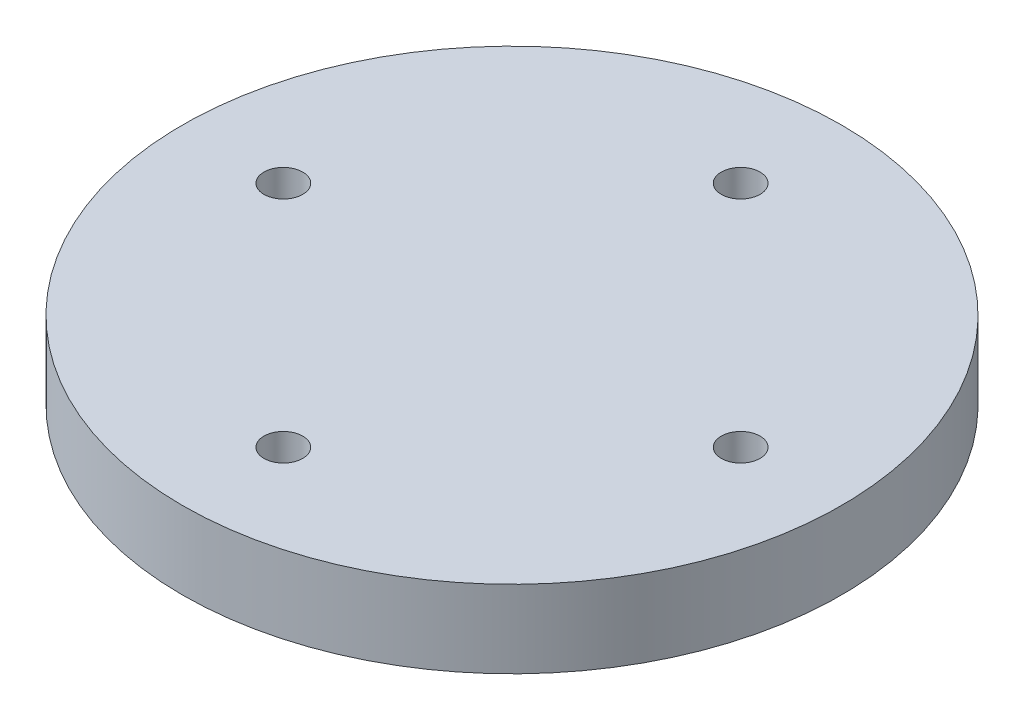
from build123d import *

# Parameters (mm, degrees)
SKETCH_1_R          = 42.5
EXTRUDE_1_DEPTH     = 10
SKETCH_2_R          = 7
CUT_EXTRUDE_1_DEPTH = 6
SKETCH_3_R          = 2.5
CUT_EXTRUDE_2_DEPTH = 6


with BuildPart() as part:
    # Эскиз1 → Вытянуть1 (new body)
    with BuildSketch(Plane(origin=(0, 0, 0), x_dir=(1, 0, 0), z_dir=(0, 1, 0))):
        with Locations(Location((0, 0, 0), (0, 0, 270))):
            Circle(SKETCH_1_R)
    extrude(amount=EXTRUDE_1_DEPTH)

    # Эскиз2 → Вырез-Вытянуть1 (cut)
    with BuildSketch(Plane.XZ):
        with Locations(Location((-29.48960133, 0, 0), (0, 0, 270))):
            Circle(SKETCH_2_R)
        with Locations(Location((0, 29.48960133, 0), (0, 0, 270))):
            Circle(SKETCH_2_R)
        with Locations(Location((29.48960133, 0, 0), (0, 0, 270))):
            Circle(SKETCH_2_R)
        with Locations(Location((0, -29.48960133, 0), (0, 0, 270))):
            Circle(SKETCH_2_R)
    extrude(amount=-CUT_EXTRUDE_1_DEPTH, mode=Mode.SUBTRACT)

    # Эскиз3 → Вырез-Вытянуть2 (cut)
    with BuildSketch(Plane.XZ.offset(-6)):
        with Locations(Location((-29.48960133, 0, 0), (0, 0, 270))):
            Circle(SKETCH_3_R)
        with Locations(Location((0, 29.48960133, 0), (0, 0, 270))):
            Circle(SKETCH_3_R)
        with Locations(Location((29.48960133, 0, 0), (0, 0, 270))):
            Circle(SKETCH_3_R)
        with Locations(Location((0, -29.48960133, 0), (0, 0, 270))):
            Circle(SKETCH_3_R)
    extrude(amount=-CUT_EXTRUDE_2_DEPTH, mode=Mode.SUBTRACT)


solid = part.part
